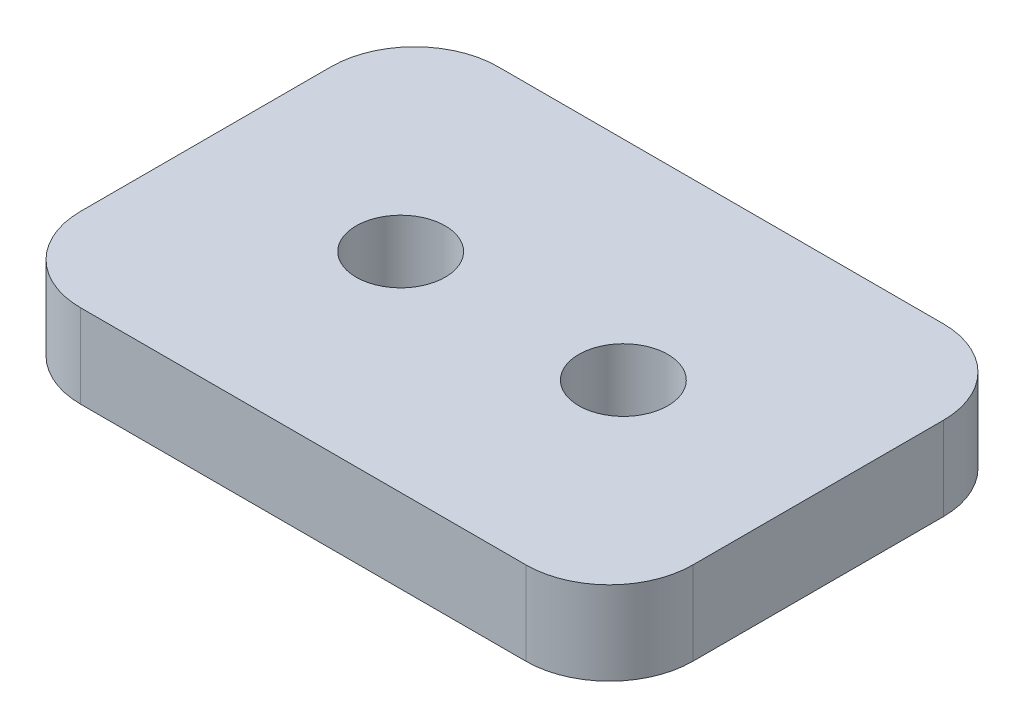
from build123d import *

# Parameters (mm, degrees)
SKETCH_1_W      = 22
SKETCH_1_H      = 15
SKETCH_1_R      = 1.6
EXTRUDE_1_DEPTH = 3
FILLET_1_R      = 3


with BuildPart() as part:
    # 草图1 → 凸台-拉伸1 (new body)
    with BuildSketch(Plane(origin=(0, 0, 0), x_dir=(1, 0, 0), z_dir=(0, 1, 0))):
        Rectangle(SKETCH_1_W, SKETCH_1_H)
        with Locations(Location((-4, 0, 0), (0, 0, 270))):
            Circle(SKETCH_1_R, mode=Mode.SUBTRACT)
        with Locations(Location((4, 0, 0), (0, 0, 270))):
            Circle(SKETCH_1_R, mode=Mode.SUBTRACT)
    extrude(amount=EXTRUDE_1_DEPTH)

    # 圆角1
    fillet_1_edges = [part.edges().sort_by_distance(p)[0] for p in [
        (11, 1.5, 7.5),
        (-11, 1.5, 7.5),
        (-11, 1.5, -7.5),
        (11, 1.5, -7.5),
    ]]
    fillet(fillet_1_edges, radius=FILLET_1_R)


solid = part.part
